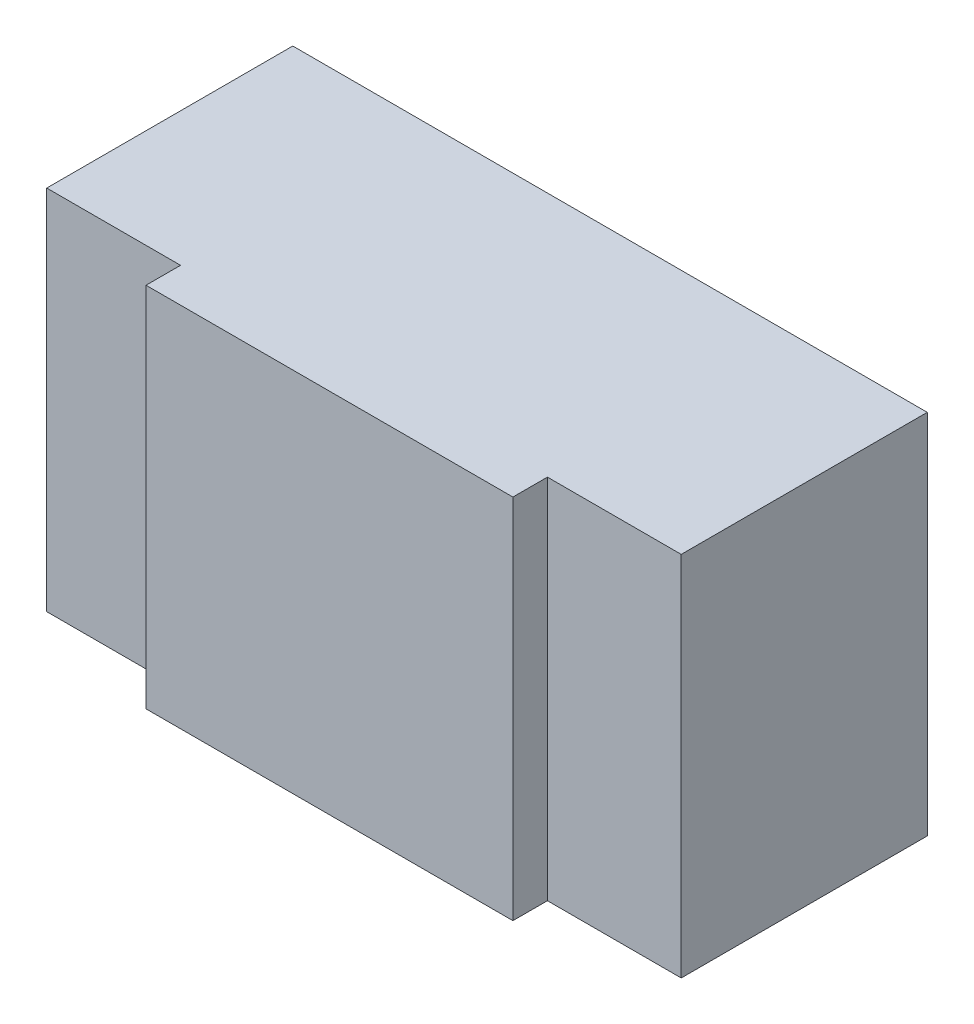
from build123d import *

# Parameters (mm, degrees)
SKETCH1_W           = 147
SKETCH1_H           = 85
BOSS_EXTRUDE1_DEPTH = 57
SKETCH2_W           = 85
SKETCH2_H           = 85
BOSS_EXTRUDE2_DEPTH = 8
SKETCH3_W           = 24
SKETCH3_H           = 31
BOSS_EXTRUDE3_DEPTH = 1


with BuildPart() as part:
    # Sketch1 → Boss-Extrude1 (new body)
    with BuildSketch(Plane.XY):
        Rectangle(SKETCH1_W, SKETCH1_H)
    extrude(amount=BOSS_EXTRUDE1_DEPTH)

    # Sketch2 → Boss-Extrude2 (add)
    with BuildSketch(Plane.XY.offset(57)):
        Rectangle(SKETCH2_W, SKETCH2_H)
    extrude(amount=BOSS_EXTRUDE2_DEPTH)

    # Sketch3 → Boss-Extrude3 (add)
    with BuildSketch(Plane.ZY.offset(73.5)):
        with Locations((42, -20)):
            Rectangle(SKETCH3_W, SKETCH3_H)
    extrude(amount=BOSS_EXTRUDE3_DEPTH)


solid = part.part
